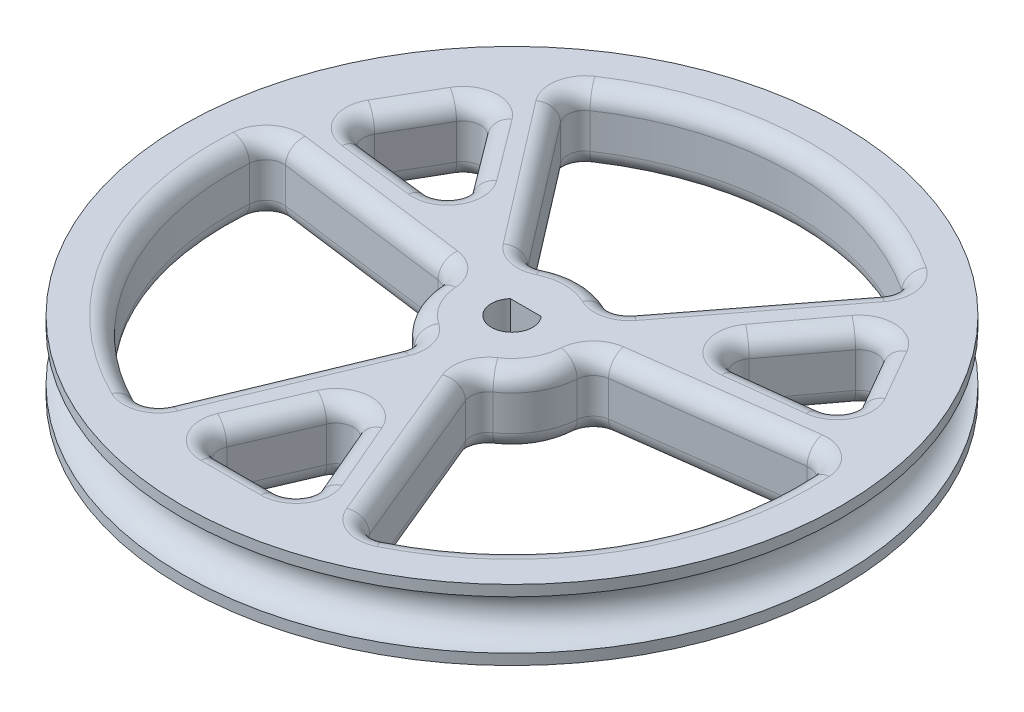
from build123d import *

# Parameters (mm, degrees)
SKETCH1_R                 = 23.815610662
BOSS_EXTRUDE1_DEPTH       = 5.08
CUT_EXTRUDE1_DEPTH        = 5.08
CUT_EXTRUDE3_DEPTH        = 35.061312694
FILLET22_R                = 1.27
CIRPATTERN1_COUNT         = 3
FILLET22_OF_CIRPATTERN1_R = 1.27
CUT_EXTRUDE4_DEPTH        = 5.08
FILLET23_R                = 1.27
CIRPATTERN2_COUNT         = 3
FILLET23_OF_CIRPATTERN2_R = 1.27


with BuildPart() as part:
    # Sketch1 → Boss-Extrude1 (new body)
    with BuildSketch(Plane(origin=(0, 0, 0), x_dir=(1, 0, 0), z_dir=(0, 1, 0))):
        with Locations(Location((0, 0, 0), (0, 0, 270))):
            Circle(SKETCH1_R)
    extrude(amount=BOSS_EXTRUDE1_DEPTH)

    # Sketch2 → Cut-Extrude1 (cut)
    with BuildSketch(Plane(origin=(0, 5.08, 0), x_dir=(1, 0, 0), z_dir=(0, 1, 0))):
        with BuildLine():
            Line((-1.114562695, 0.99225), (1.114562695, 0.99225))
            ThreePointArc((1.114562695, 0.99225), (0, -1.49225), (-1.114562695, 0.99225))
        make_face()
    extrude(amount=-CUT_EXTRUDE1_DEPTH, mode=Mode.SUBTRACT)

    # Sketch5 → Cut-Revolve2 (revolve, cut)
    with BuildSketch(Plane.XY, mode=Mode.PRIVATE) as cut_revolve2_sk:
        with BuildLine():
            Line((-23.815610662, 4.3053), (-23.815610662, 0.7747))
            ThreePointArc((-23.815610662, 0.7747), (-22.050310662, 2.54), (-23.815610662, 4.3053))
        make_face()
    revolve(cut_revolve2_sk.sketch.rotate(Axis((0, 4.3287014, 0), (0, -1, 0)), 270), axis=Axis((0, 4.3287014, 0), (0, -1, 0)), mode=Mode.SUBTRACT)

    # Sketch8 → Cut-Extrude3 (cut, through all)
    with BuildSketch(Plane(origin=(0, 5.08, 0), x_dir=(1, 0, 0), z_dir=(0, 1, 0))):
        with BuildLine():
            Line((3.092508059, 4.030234969), (12.370032237, 16.120939875))
            ThreePointArc((12.370032237, 16.120939875), (0, 20.32), (-12.370032237, 16.120939875))
            Line((-12.370032237, 16.120939875), (-3.092508059, 4.030234969))
            ThreePointArc((-3.092508059, 4.030234969), (0, 5.08), (3.092508059, 4.030234969))
        make_face()
    cut_extrude3 = extrude(amount=-CUT_EXTRUDE3_DEPTH, mode=Mode.SUBTRACT)

    # Fillet22
    fillet22_edges = [part.edges().sort_by_distance(p)[0] for p in [
        (-7.731270148, 0, -10.075587422),
        (-3.092508059, 2.54, -4.030234969),
        (0, 5.08, -20.32),
        (-12.370032237, 2.54, -16.120939875),
        (7.731270148, 0, -10.075587422),
        (12.370032237, 2.54, -16.120939875),
        (0, 0, -5.08),
        (3.092508059, 2.54, -4.030234969),
        (0, 0, -20.32),
        (-7.731270148, 5.08, -10.075587422),
        (0, 5.08, -5.08),
        (7.731270148, 5.08, -10.075587422),
    ]]
    fillet(fillet22_edges, radius=FILLET22_R)

    # CirPattern1: Cut-Extrude3 ×3 about axis
    cirpattern1_axis = Axis((0, 5.08, 0), (0, 1, 0))
    for i in range(1, CIRPATTERN1_COUNT):
        add(cut_extrude3.rotate(cirpattern1_axis, i * 360 / CIRPATTERN1_COUNT), mode=Mode.SUBTRACT)

    # Fillet22 of CirPattern1
    fillet22_of_cirpattern1_edges = [part.edges().sort_by_distance(p)[0] for p in [
        (-4.860079591, 0, 11.733270063),
        (-1.944031836, 2.54, 4.693308025),
        (-17.597636205, 5.08, 10.16),
        (-7.776127346, 2.54, 18.773232101),
        (-12.591349739, 0, -1.657682641),
        (-20.146159583, 2.54, -2.652292226),
        (-4.399409051, 0, 2.54),
        (-5.036539896, 2.54, -0.663073056),
        (-17.597636205, 0, 10.16),
        (-4.860079591, 5.08, 11.733270063),
        (-4.399409051, 5.08, 2.54),
        (-12.591349739, 5.08, -1.657682641),
        (12.591349739, 0, -1.657682641),
        (5.036539896, 2.54, -0.663073056),
        (17.597636205, 5.08, 10.16),
        (20.146159583, 2.54, -2.652292226),
        (4.860079591, 0, 11.733270063),
        (7.776127346, 2.54, 18.773232101),
        (4.399409051, 0, 2.54),
        (1.944031836, 2.54, 4.693308025),
        (17.597636205, 0, 10.16),
        (12.591349739, 5.08, -1.657682641),
        (4.399409051, 5.08, 2.54),
        (4.860079591, 5.08, 11.733270063),
    ]]
    fillet(fillet22_of_cirpattern1_edges, radius=FILLET22_OF_CIRPATTERN1_R)

    # Sketch9 → Cut-Extrude4 (cut)
    with BuildSketch(Plane(origin=(0, 5.08, 0), x_dir=(1, 0, 0), z_dir=(0, 1, 0))):
        Polygon((-4.095857255, -19.05), (4.095857255, -19.05), (0, -9.514990029), align=None)
    cut_extrude4 = extrude(amount=-CUT_EXTRUDE4_DEPTH, mode=Mode.SUBTRACT)

    # Fillet23
    fillet23_edges = [part.edges().sort_by_distance(p)[0] for p in [
        (-4.095857255, 2.54, 19.05),
        (0, 2.54, 9.514990029),
        (4.095857255, 2.54, 19.05),
        (-2.047928627, 5.08, 14.282495014),
        (0, 5.08, 19.05),
        (2.047928627, 5.08, 14.282495014),
        (-2.047928627, 0, 14.282495014),
        (2.047928627, 0, 14.282495014),
        (0, 0, 19.05),
    ]]
    fillet(fillet23_edges, radius=FILLET23_R)

    # CirPattern2: Cut-Extrude4 ×3 about axis
    cirpattern2_axis = Axis((0, 0, 0), (0, 1, 0))
    for i in range(1, CIRPATTERN2_COUNT):
        add(cut_extrude4.rotate(cirpattern2_axis, i * 360 / CIRPATTERN2_COUNT), mode=Mode.SUBTRACT)

    # Fillet23 of CirPattern2
    fillet23_of_cirpattern2_edges = [part.edges().sort_by_distance(p)[0] for p in [
        (18.54571257, 2.54, -5.977883567),
        (8.240223082, 2.54, -4.757495014),
        (14.449855315, 2.54, -13.072116433),
        (13.392967826, 5.08, -5.367689291),
        (16.497783942, 5.08, -9.525),
        (11.345039198, 5.08, -8.914805724),
        (13.392967826, 0, -5.367689291),
        (11.345039198, 0, -8.914805724),
        (16.497783942, 0, -9.525),
        (-14.449855315, 2.54, -13.072116433),
        (-8.240223082, 2.54, -4.757495014),
        (-18.54571257, 2.54, -5.977883567),
        (-11.345039198, 5.08, -8.914805724),
        (-16.497783942, 5.08, -9.525),
        (-13.392967826, 5.08, -5.367689291),
        (-11.345039198, 0, -8.914805724),
        (-13.392967826, 0, -5.367689291),
        (-16.497783942, 0, -9.525),
    ]]
    fillet(fillet23_of_cirpattern2_edges, radius=FILLET23_OF_CIRPATTERN2_R)


solid = part.part
